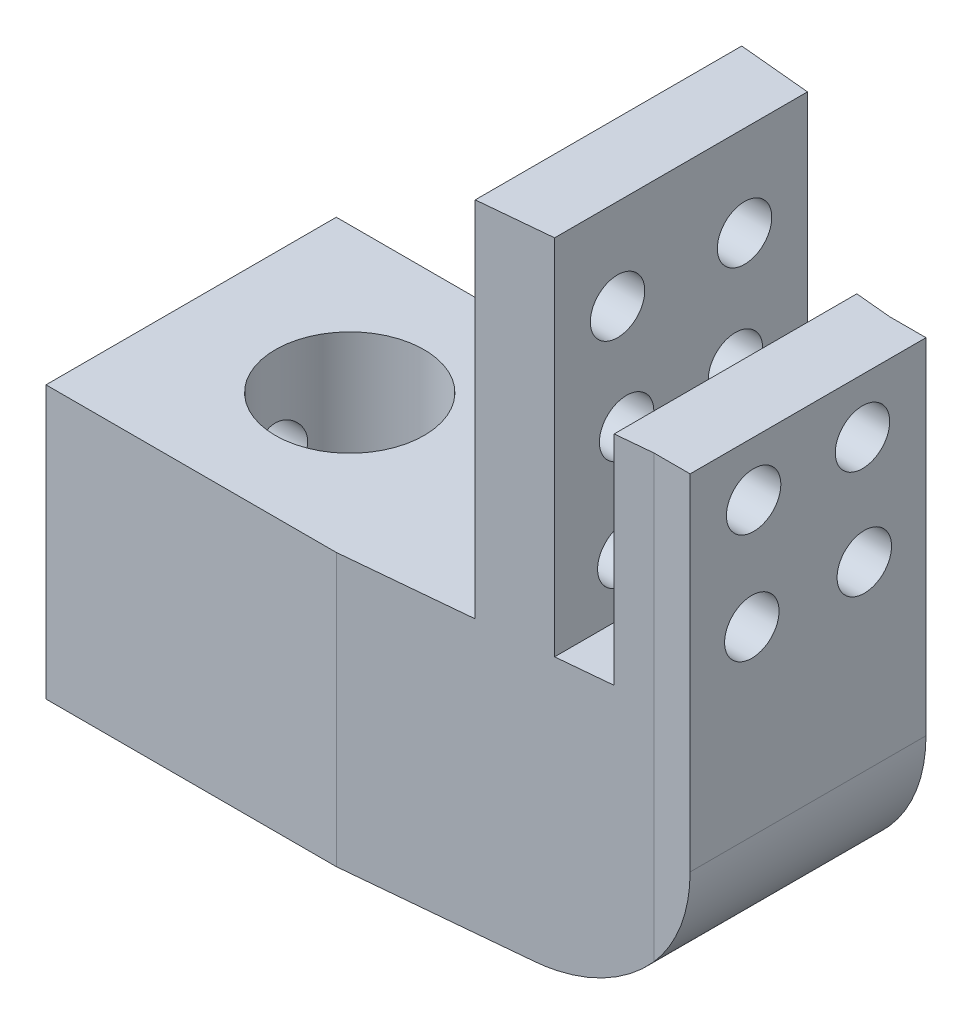
from build123d import *

# Parameters (mm, degrees)
BOSS_EXTRUDE1_DEPTH     = 7.5
SKETCH4_R               = 4.1
CUT_EXTRUDE1_DEPTH      = 10
SKETCH5_R               = 1.5
CUT_EXTRUDE2_DEPTH      = 5
CUT_EXTRUDE4_REACH      = 40.591
CUT_EXTRUDE4_END_RADIUS = 4.1
SKETCH7_R               = 1.5
BOSS_EXTRUDE2_DEPTH     = 20
CUT_EXTRUDE5_DEPTH      = 20
CUT_EXTRUDE6_DEPTH      = 8
SKETCH13_R              = 1.5
CUT_EXTRUDE7_DEPTH      = 16
SKETCH14_R              = 1.5
CUT_EXTRUDE8_DEPTH      = 4
CUT_EXTRUDE9_START      = -1
CUT_EXTRUDE9_DEPTH      = 2.6
SKETCH16_W              = 3
SKETCH16_H              = 13
CUT_EXTRUDE10_DEPTH     = 36.128336141
FILLET1_R               = 8


with BuildPart() as part:
    # Sketch2 → Boss-Extrude1 (new, symmetric)
    with BuildSketch(Plane(origin=(0, 0, 0), x_dir=(1, 0, 0), z_dir=(0, 1, 0))):
        Polygon((-16, -8), (-16, 8), (0, 8), (16, 6.5), (21, 6.5), (21, -6.5), (16, -6.5), (0, -8), align=None)
    extrude(amount=BOSS_EXTRUDE1_DEPTH, both=True)

    # Sketch4 → Cut-Extrude1 (cut)
    with BuildSketch(Plane(origin=(0, 7.5, 0), x_dir=(1, 0, 0), z_dir=(0, 1, 0))):
        with Locations(Location((-7.259972257, 0, 0), (0, 0, 270))):
            Circle(SKETCH4_R)
    extrude(amount=-CUT_EXTRUDE1_DEPTH, mode=Mode.SUBTRACT)

    # Sketch5 → Cut-Extrude2 (cut)
    with BuildSketch(Plane(origin=(0, -2.5, 0), x_dir=(1, 0, 0), z_dir=(0, 1, 0))):
        with Locations(Location((-7.259972257, 0, 0), (0, 0, 270))):
            Circle(SKETCH5_R)
    extrude(amount=-CUT_EXTRUDE2_DEPTH, mode=Mode.SUBTRACT)

    # Cut-Extrude4: up to this cylinder (the profile starts outside it)
    cut_extrude4_end = Plane(origin=(-7.259972257, 2.5, 0), z_dir=(0, 1, 0)) * Cylinder(CUT_EXTRUDE4_END_RADIUS, 90.382, mode=Mode.PRIVATE)
    # Sketch7 → Cut-Extrude4 (cut, up to the surface)
    with BuildSketch(Plane.ZY.offset(16), mode=Mode.PRIVATE) as cut_extrude4_sk1:
        with Locations((0, 2.5)):
            Circle(SKETCH7_R)
    cut_extrude4_tool1 = extrude(cut_extrude4_sk1.sketch, amount=-CUT_EXTRUDE4_REACH, mode=Mode.PRIVATE) - cut_extrude4_end
    add(cut_extrude4_tool1.solids().sort_by_distance((-16, 2.5, 0))[0], mode=Mode.SUBTRACT)

    # Sketch8 → Boss-Extrude2 (add)
    with BuildSketch(Plane(origin=(0, 7.5, 0), x_dir=(1, 0, 0), z_dir=(0, 1, 0))):
        Polygon((7, 7.34375), (7, -7.34375), (16, -6.5), (21, -6.5), (21, 6.5), (16, 6.5), align=None)
    extrude(amount=BOSS_EXTRUDE2_DEPTH)

    # Sketch11 → Cut-Extrude5 (cut)
    with BuildSketch(Plane(origin=(0, 27.5, 0), x_dir=(1, 0, 0), z_dir=(0, 1, 0))):
        Polygon((11, 6.96875), (11, -6.96875), (14, -6.6875), (14, 6.6875), align=None)
    extrude(amount=-CUT_EXTRUDE5_DEPTH, mode=Mode.SUBTRACT)

    # Sketch12 → Cut-Extrude6 (cut)
    with BuildSketch(Plane(origin=(0, 27.5, 0), x_dir=(1, 0, 0), z_dir=(0, 1, 0))):
        Polygon((14, 6.6875), (14, -6.6875), (16, -6.5), (21, -6.5), (21, 6.5), (16, 6.5), align=None)
    extrude(amount=-CUT_EXTRUDE6_DEPTH, mode=Mode.SUBTRACT)

    # Sketch13 → Cut-Extrude7 (cut)
    with BuildSketch(Plane(origin=(21, 0, 0), x_dir=(0, 0, -1), z_dir=(1, 0, 0))):
        with Locations((-3, 16.5)):
            Circle(SKETCH13_R)
        with Locations((3, 16.5)):
            Circle(SKETCH13_R)
        with Locations((-3.1, 10.5)):
            Circle(SKETCH13_R)
        with Locations((3.1, 10.5)):
            Circle(SKETCH13_R)
    extrude(amount=-CUT_EXTRUDE7_DEPTH, mode=Mode.SUBTRACT)

    # Sketch14 → Cut-Extrude8 (cut)
    with BuildSketch(Plane.ZY.offset(-7)):
        with Locations((-3.5, 22.5)):
            Circle(SKETCH14_R)
        with Locations((3.5, 22.5)):
            Circle(SKETCH14_R)
    extrude(amount=-CUT_EXTRUDE8_DEPTH, mode=Mode.SUBTRACT)

    # Sketch15 → Cut-Extrude9 (cut)
    with BuildSketch(Plane.ZY.offset(-7).offset(CUT_EXTRUDE9_START)):
        Polygon((4.658845727, 13.2), (1.541154273, 13.2), (-0.017691454, 10.5), (1.541154273, 7.8), (4.658845727, 7.8), (6.217691454, 10.5), align=None)
    cut_extrude9 = extrude(amount=CUT_EXTRUDE9_DEPTH, mode=Mode.SUBTRACT)

    # Mirror1: Cut-Extrude9 across plane
    add(cut_extrude9.mirror(Plane.XY), mode=Mode.SUBTRACT)

    # Sketch16 → Cut-Extrude10 (cut, through all)
    with BuildSketch(Plane(origin=(0, 19.5, 0), x_dir=(1, 0, 0), z_dir=(0, 1, 0))):
        with Locations((19.5, 0)):
            Rectangle(SKETCH16_W, SKETCH16_H)
    extrude(amount=-CUT_EXTRUDE10_DEPTH, mode=Mode.SUBTRACT)

    # Fillet1
    fillet1_edges = [part.edges().sort_by_distance(p)[0] for p in [
        (18, -7.5, 0),
    ]]
    fillet(fillet1_edges, radius=FILLET1_R)


solid = part.part
